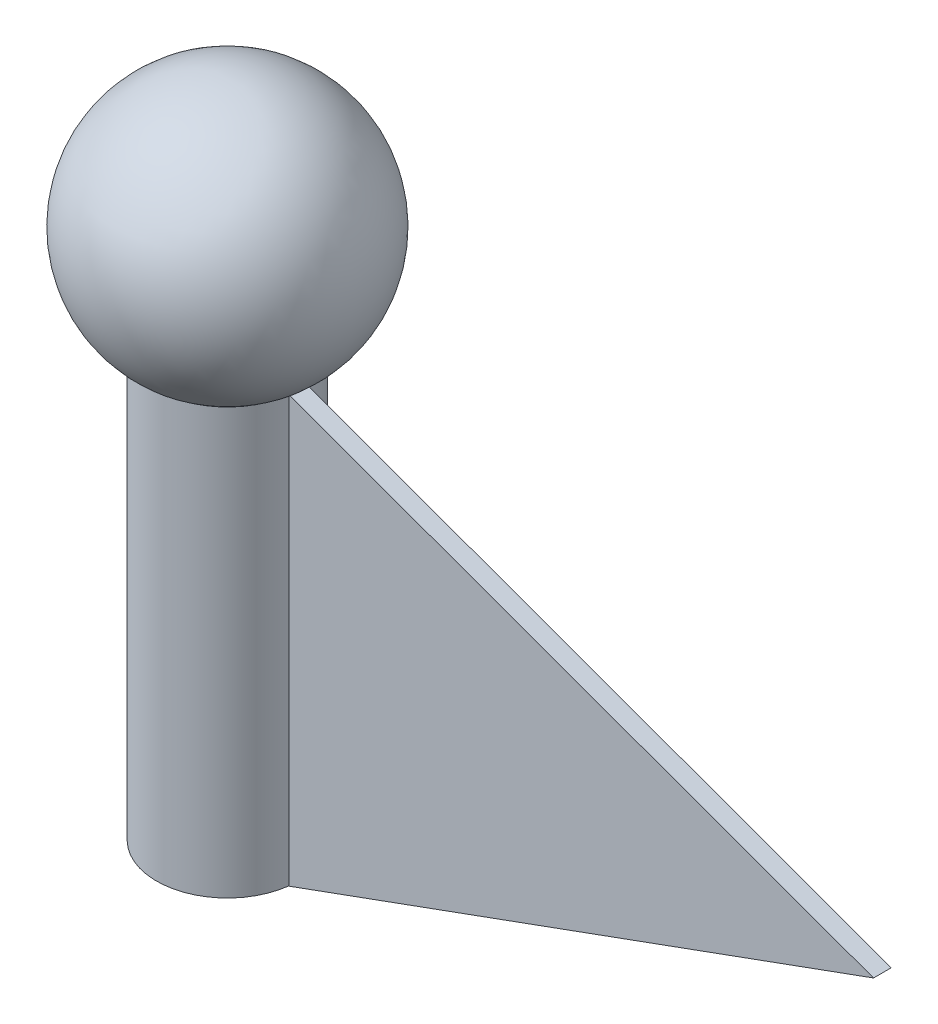
from build123d import *

# Parameters (mm, degrees)
SKETCH2_R           = 25.4
BOSS_EXTRUDE1_DEPTH = 152.4
BOSS_EXTRUDE2_DEPTH = 3.175


with BuildPart() as part:
    # Sketch2 → Boss-Extrude1 (new body)
    with BuildSketch(Plane(origin=(0, 0, 0), x_dir=(1, 0, 0), z_dir=(0, 1, 0))):
        with Locations(Location((0, 0, 0), (0, 0, 90))):
            Circle(SKETCH2_R)
    extrude(amount=BOSS_EXTRUDE1_DEPTH)

    # Sketch5 → 1 NPT Tapped Hole1 (revolve, cut)
    with BuildSketch(Plane(origin=(0, 0, 0), x_dir=(0, 0, -1), z_dir=(1, 0, 0))):
        Polygon((0, 0), (0, 59.506890972), (14.4907, 50.8), (14.4907, 16.764), (15.206530434, 16.764), (15.7298898, 0), align=None)
    revolve(axis=Axis((0, -6.35, 0), (0, 1, 0)), mode=Mode.SUBTRACT)



with BuildPart() as body_2:
    # Sketch7 → Boss-Extrude2 (new, symmetric)
    with BuildSketch(Plane.XY):
        Polygon((25.4, 152.4), (234.757779362, 76.2), (25.4, 0), (20.492740143, 0), (20.492740143, 152.4), align=None)
    extrude(amount=BOSS_EXTRUDE2_DEPTH, both=True)


with BuildPart() as part_1:
    add(part.part)

    add(body_2.part)  # Revolve1 merges body 2
    # Sketch8 → Revolve1 (revolve)
    with BuildSketch(Plane.XY):
        with BuildLine():
            Line((25.4, 152.4), (0, 152.4))
            Line((0, 152.4), (0, 236.290501198))
            ThreePointArc((0, 236.290501198), (43.825723586, 203.769361408), (25.4, 152.4))
        make_face()
    revolve(axis=Axis((0, 152.4, 0), (0, 1, 0)))


solid = part_1.part
